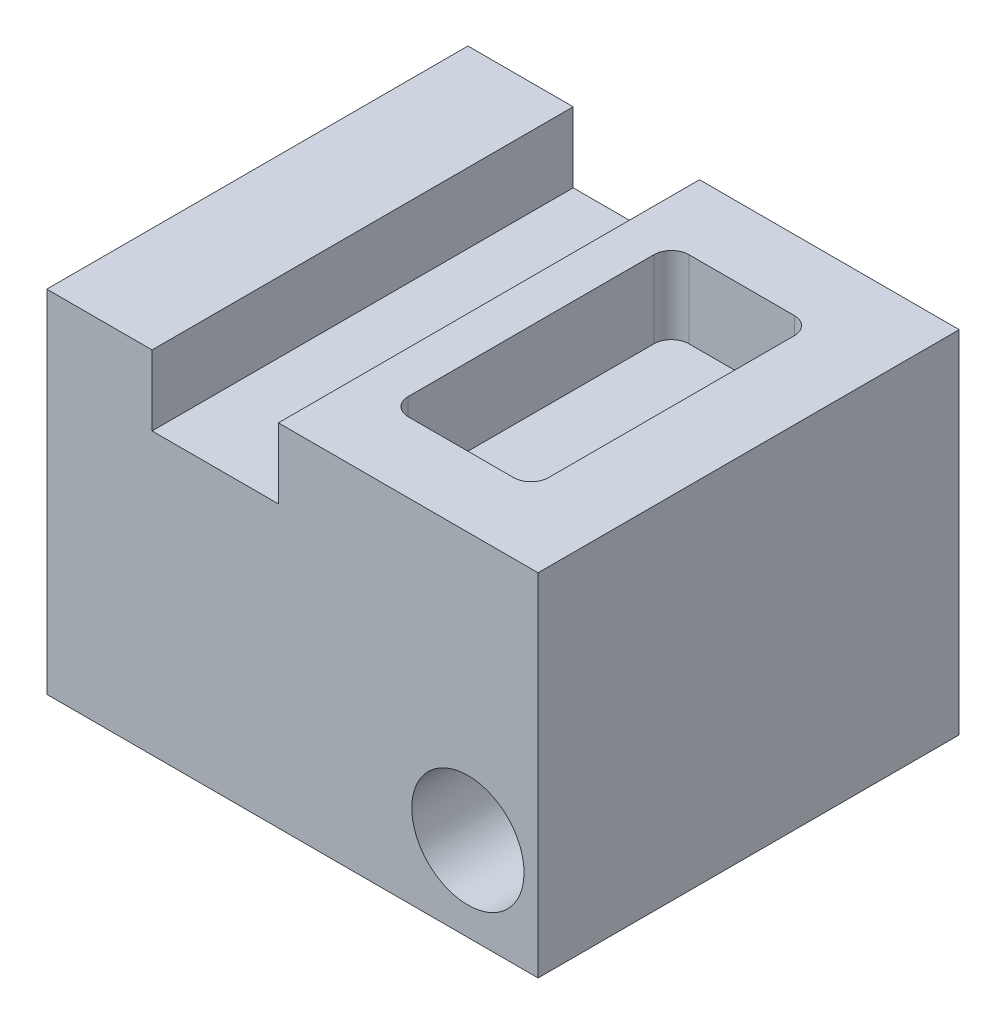
from build123d import *

# Parameters (mm, degrees)
ESBO_O7_W                                      = 70
ESBO_O7_H                                      = 50
RESSALTO_EXTRUS_O3_DEPTH                       = 60
BROCA_DE_ROSQUEAR_PARA_TARRAXA_DE_M1_2X0_D     = 16
BROCA_DE_ROSQUEAR_PARA_TARRAXA_DE_M1_2X0_DEPTH = 22
CORTE_EXTRUS_O2_DEPTH                          = 11
ESBO_O13_W                                     = 18
ESBO_O13_H                                     = 10


with BuildPart() as part:
    # Esboço7 → Ressalto-extrusão3 (new body)
    with BuildSketch(Plane.XY):
        with Locations((35, 25)):
            Rectangle(ESBO_O7_W, ESBO_O7_H)
    extrude(amount=-RESSALTO_EXTRUS_O3_DEPTH)

    # Broca de rosquear para tarraxa de M1.2x0.252
    with Locations(Plane.XY):
        with Locations((60, 12)):
            Hole(BROCA_DE_ROSQUEAR_PARA_TARRAXA_DE_M1_2X0_D / 2, depth=BROCA_DE_ROSQUEAR_PARA_TARRAXA_DE_M1_2X0_DEPTH)

    # Esboço11 → Corte-extrusão2 (cut)
    with BuildSketch(Plane(origin=(0, 50, 0), x_dir=(1, 0, 0), z_dir=(0, 1, 0))):
        with BuildLine():
            Line((41.5, 50), (56.5, 50))
            ThreePointArc((56.5, 50), (58.267766953, 49.267766953), (59, 47.5))
            Line((59, 47.5), (59, 12.5))
            ThreePointArc((59, 12.5), (58.267766953, 10.732233047), (56.5, 10))
            Line((56.5, 10), (41.5, 10))
            ThreePointArc((41.5, 10), (39.732233047, 10.732233047), (39, 12.5))
            Line((39, 12.5), (39, 47.5))
            ThreePointArc((39, 47.5), (39.732233047, 49.267766953), (41.5, 50))
        make_face()
    extrude(amount=-CORTE_EXTRUS_O2_DEPTH, mode=Mode.SUBTRACT)

    # Varredura de corte1: sweep along a path in Esboço16
    with BuildLine(Plane(origin=(0, 50, 0), x_dir=(1, 0, 0), z_dir=(0, 1, 0))) as varredura_de_corte1_path:
        Line((15, 0), (15, 60))
    # Esboço13 → Varredura de corte1 (sweep, cut)
    with BuildSketch(Plane.XY):
        with Locations((24, 45)):
            Rectangle(ESBO_O13_W, ESBO_O13_H)
    sweep(path=varredura_de_corte1_path.line, mode=Mode.SUBTRACT)


solid = part.part
